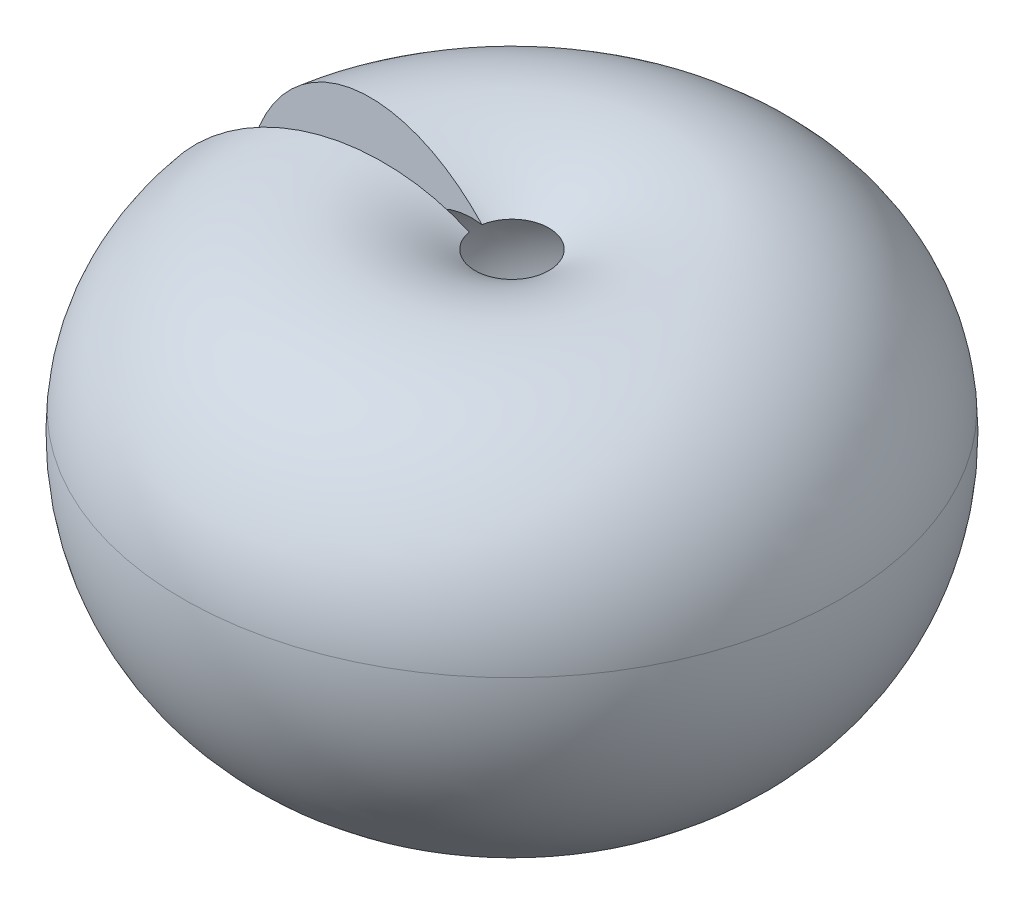
from build123d import *

# Parameters (mm, degrees)
REVOLVE4_ANGLE           = 170
REVOLVE4_OTHER_WAY_ANGLE = 170


with BuildPart() as part:
    # Sketch1 → Revolve4 (revolve)
    with BuildSketch(Plane.XY):
        with BuildLine():
            ThreePointArc((500.801994, -900.788717312), (317.543003401, -1261.262484733), (0, -1511.645462639))
            Line((0, -1511.645462639), (0, -1961.856712416))
            ThreePointArc((0, -1961.856712416), (91.557633144, -1977.666654979), (183.579211128, -1990.503463624))
            ThreePointArc((183.579211128, -1990.503463624), (1243.500436013, -1638.585287751), (1641.380716106, -595.047704248))
            ThreePointArc((1641.380716106, -595.047704248), (1112.997650555, 172.254326765), (184.413054184, 96.943516528))
            ThreePointArc((184.413054184, 96.943516528), (684.757011125, -293.424238016), (500.801994, -900.788717312))
        make_face()
    revolve(axis=Axis((0, 0, 0), (0, -1, 0)), revolution_arc=REVOLVE4_ANGLE)

    # Sketch1 → Revolve4 other way (revolve)
    with BuildSketch(Plane.XY):
        with BuildLine():
            ThreePointArc((500.801994, -900.788717312), (317.543003401, -1261.262484733), (0, -1511.645462639))
            Line((0, -1511.645462639), (0, -1961.856712416))
            ThreePointArc((0, -1961.856712416), (91.557633144, -1977.666654979), (183.579211128, -1990.503463624))
            ThreePointArc((183.579211128, -1990.503463624), (1243.500436013, -1638.585287751), (1641.380716106, -595.047704248))
            ThreePointArc((1641.380716106, -595.047704248), (1112.997650555, 172.254326765), (184.413054184, 96.943516528))
            ThreePointArc((184.413054184, 96.943516528), (684.757011125, -293.424238016), (500.801994, -900.788717312))
        make_face()
    revolve(axis=Axis((0, 0, 0), (0, 1, 0)), revolution_arc=REVOLVE4_OTHER_WAY_ANGLE)


solid = part.part
